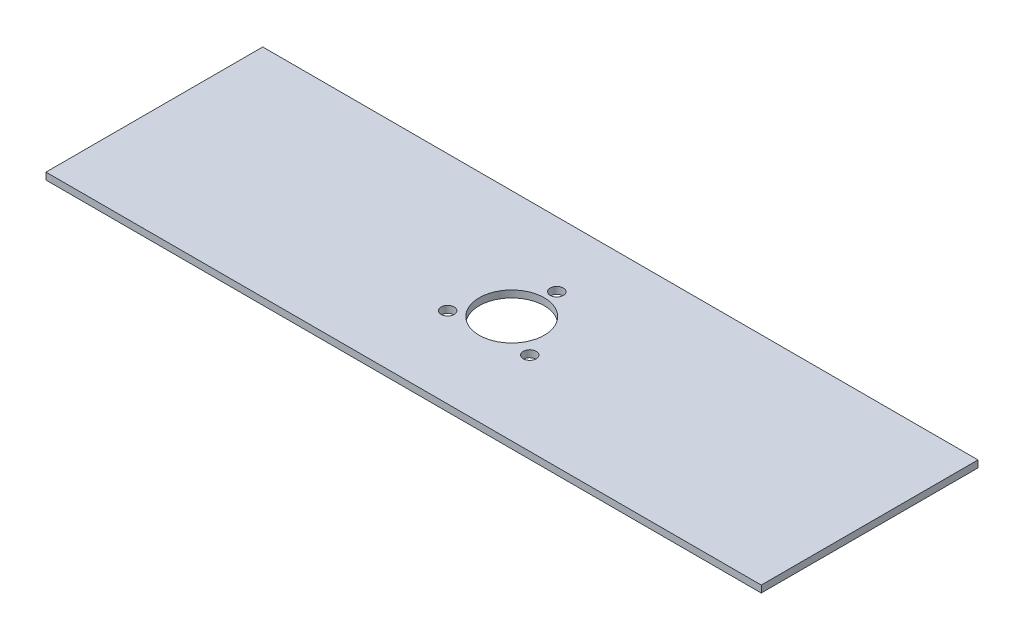
from build123d import *

# Parameters (mm, degrees)
SKETCH1_W             = 165
SKETCH1_H             = 50
BOSS_EXTRUDE1_DEPTH   = 1.6
F_5_0MM_DOWEL_HOLE1_D = 15
F_3_0MM_DOWEL_HOLE1_D = 3
F_3_0MM_DOWEL_HOLE2_D = 3
F_3_0MM_DOWEL_HOLE3_D = 3


with BuildPart() as part:
    # Sketch1 → Boss-Extrude1 (new body)
    with BuildSketch(Plane(origin=(0, 0, 0), x_dir=(1, 0, 0), z_dir=(0, 1, 0))):
        with Locations((-9.486062718, 16.824912892)):
            Rectangle(SKETCH1_W, SKETCH1_H)
    extrude(amount=BOSS_EXTRUDE1_DEPTH)

    # Ø5.0mm Dowel Hole1 (through all)
    with Locations(Plane(origin=(0, 1.6, 0), x_dir=(1, 0, 0), z_dir=(0, 1, 0))):
        with Locations((-9.417861972, 16.694999661)):
            Hole(F_5_0MM_DOWEL_HOLE1_D / 2)

    # Ø3.0mm Dowel Hole1 (through all)
    with Locations(Plane(origin=(0, 1.6, 0), x_dir=(1, 0, 0), z_dir=(0, 1, 0))):
        with Locations((-9.173425023, 26.839133027)):
            Hole(F_3_0MM_DOWEL_HOLE1_D / 2)

    # Ø3.0mm Dowel Hole2 (through all)
    with Locations(Plane(origin=(0, 1.6, 0), x_dir=(1, 0, 0), z_dir=(0, 1, 0))):
        with Locations((0.359615971, 11.072949843)):
            Hole(F_3_0MM_DOWEL_HOLE2_D / 2)

    # Ø3.0mm Dowel Hole3 (through all)
    with Locations(Plane(origin=(0, 1.6, 0), x_dir=(1, 0, 0), z_dir=(0, 1, 0))):
        with Locations((-17.973155173, 10.461857472)):
            Hole(F_3_0MM_DOWEL_HOLE3_D / 2)


solid = part.part
